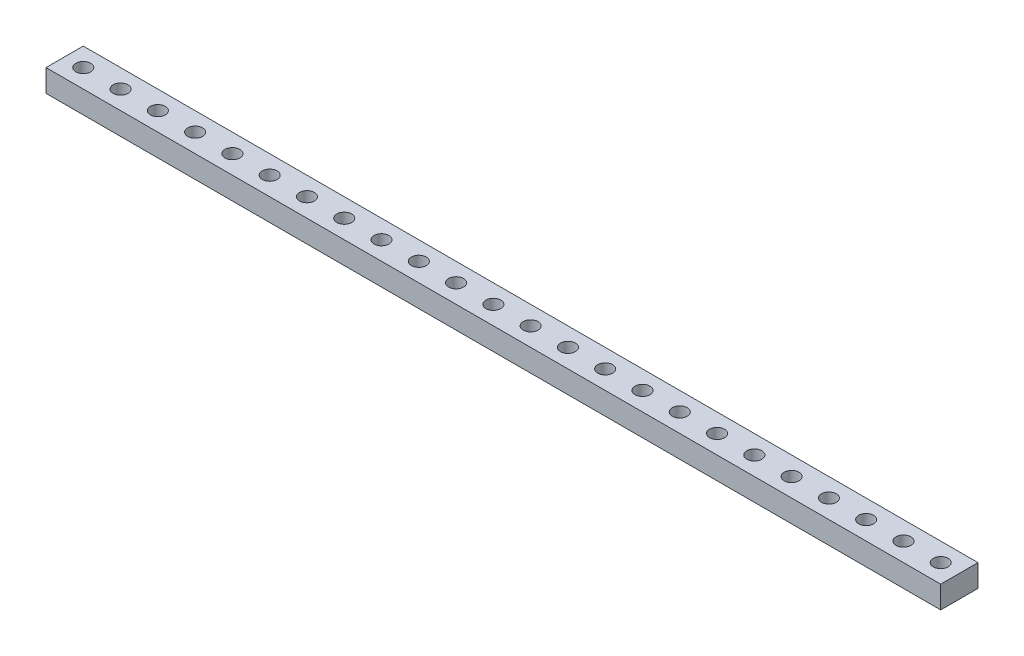
from build123d import *

# Parameters (mm, degrees)
ESQUISSE1_R             = 2
BOSS_EXTRU_1_DEPTH      = 6
ENL_V_MAT_EXTRU_1_REACH = 142.485
ESQUISSE2_W             = 40
ESQUISSE2_H             = 10


with BuildPart() as part:
    # Esquisse1 → Boss.-Extru.1 (new body)
    with BuildSketch(Plane(origin=(0, 0, 0), x_dir=(1, 0, 0), z_dir=(0, 1, 0))):
        Polygon((0, 0), (140, 0), (140, 10), (-140, 10), (-140, 0), align=None)
        with Locations(Location((-135, 5, 0), (0, 0, 270))):
            Circle(ESQUISSE1_R, mode=Mode.SUBTRACT)
        with Locations(Location((-125, 5, 0), (0, 0, 270))):
            Circle(ESQUISSE1_R, mode=Mode.SUBTRACT)
        with Locations(Location((-115, 5, 0), (0, 0, 270))):
            Circle(ESQUISSE1_R, mode=Mode.SUBTRACT)
        with Locations(Location((-105, 5, 0), (0, 0, 270))):
            Circle(ESQUISSE1_R, mode=Mode.SUBTRACT)
        with Locations(Location((-95, 5, 0), (0, 0, 270))):
            Circle(ESQUISSE1_R, mode=Mode.SUBTRACT)
        with Locations(Location((-85, 5, 0), (0, 0, 270))):
            Circle(ESQUISSE1_R, mode=Mode.SUBTRACT)
        with Locations(Location((-75, 5, 0), (0, 0, 270))):
            Circle(ESQUISSE1_R, mode=Mode.SUBTRACT)
        with Locations(Location((-65, 5, 0), (0, 0, 270))):
            Circle(ESQUISSE1_R, mode=Mode.SUBTRACT)
        with Locations(Location((-55, 5, 0), (0, 0, 270))):
            Circle(ESQUISSE1_R, mode=Mode.SUBTRACT)
        with Locations(Location((-45, 5, 0), (0, 0, 270))):
            Circle(ESQUISSE1_R, mode=Mode.SUBTRACT)
        with Locations(Location((-35, 5, 0), (0, 0, 270))):
            Circle(ESQUISSE1_R, mode=Mode.SUBTRACT)
        with Locations(Location((-25, 5, 0), (0, 0, 270))):
            Circle(ESQUISSE1_R, mode=Mode.SUBTRACT)
        with Locations(Location((-15, 5, 0), (0, 0, 270))):
            Circle(ESQUISSE1_R, mode=Mode.SUBTRACT)
        with Locations(Location((-5, 5, 0), (0, 0, 270))):
            Circle(ESQUISSE1_R, mode=Mode.SUBTRACT)
        with Locations(Location((5, 5, 0), (0, 0, 270))):
            Circle(ESQUISSE1_R, mode=Mode.SUBTRACT)
        with Locations(Location((15, 5, 0), (0, 0, 270))):
            Circle(ESQUISSE1_R, mode=Mode.SUBTRACT)
        with Locations(Location((25, 5, 0), (0, 0, 270))):
            Circle(ESQUISSE1_R, mode=Mode.SUBTRACT)
        with Locations(Location((35, 5, 0), (0, 0, 270))):
            Circle(ESQUISSE1_R, mode=Mode.SUBTRACT)
        with Locations(Location((45, 5, 0), (0, 0, 270))):
            Circle(ESQUISSE1_R, mode=Mode.SUBTRACT)
        with Locations(Location((55, 5, 0), (0, 0, 270))):
            Circle(ESQUISSE1_R, mode=Mode.SUBTRACT)
        with Locations(Location((65, 5, 0), (0, 0, 270))):
            Circle(ESQUISSE1_R, mode=Mode.SUBTRACT)
        with Locations(Location((75, 5, 0), (0, 0, 270))):
            Circle(ESQUISSE1_R, mode=Mode.SUBTRACT)
        with Locations(Location((85, 5, 0), (0, 0, 270))):
            Circle(ESQUISSE1_R, mode=Mode.SUBTRACT)
        with Locations(Location((95, 5, 0), (0, 0, 270))):
            Circle(ESQUISSE1_R, mode=Mode.SUBTRACT)
        with Locations(Location((105, 5, 0), (0, 0, 270))):
            Circle(ESQUISSE1_R, mode=Mode.SUBTRACT)
        with Locations(Location((115, 5, 0), (0, 0, 270))):
            Circle(ESQUISSE1_R, mode=Mode.SUBTRACT)
        with Locations(Location((125, 5, 0), (0, 0, 270))):
            Circle(ESQUISSE1_R, mode=Mode.SUBTRACT)
        with Locations(Location((135, 5, 0), (0, 0, 270))):
            Circle(ESQUISSE1_R, mode=Mode.SUBTRACT)
    extrude(amount=BOSS_EXTRU_1_DEPTH)

    # Esquisse2 → Enlèv. mat.-Extru.1 (cut, up to next)
    with BuildSketch(Plane(origin=(0, 6, 0), x_dir=(1, 0, 0), z_dir=(0, 1, 0)), mode=Mode.PRIVATE) as enl_v_mat_extru_1_sk1:
        with Locations((120, 5)):
            Rectangle(ESQUISSE2_W, ESQUISSE2_H)
    enl_v_mat_extru_1_tool1 = extrude(enl_v_mat_extru_1_sk1.sketch, amount=-ENL_V_MAT_EXTRU_1_REACH, mode=Mode.PRIVATE) & part.part
    add(enl_v_mat_extru_1_tool1.solids().sort_by_distance((120, 6, -5))[0], mode=Mode.SUBTRACT)


solid = part.part
